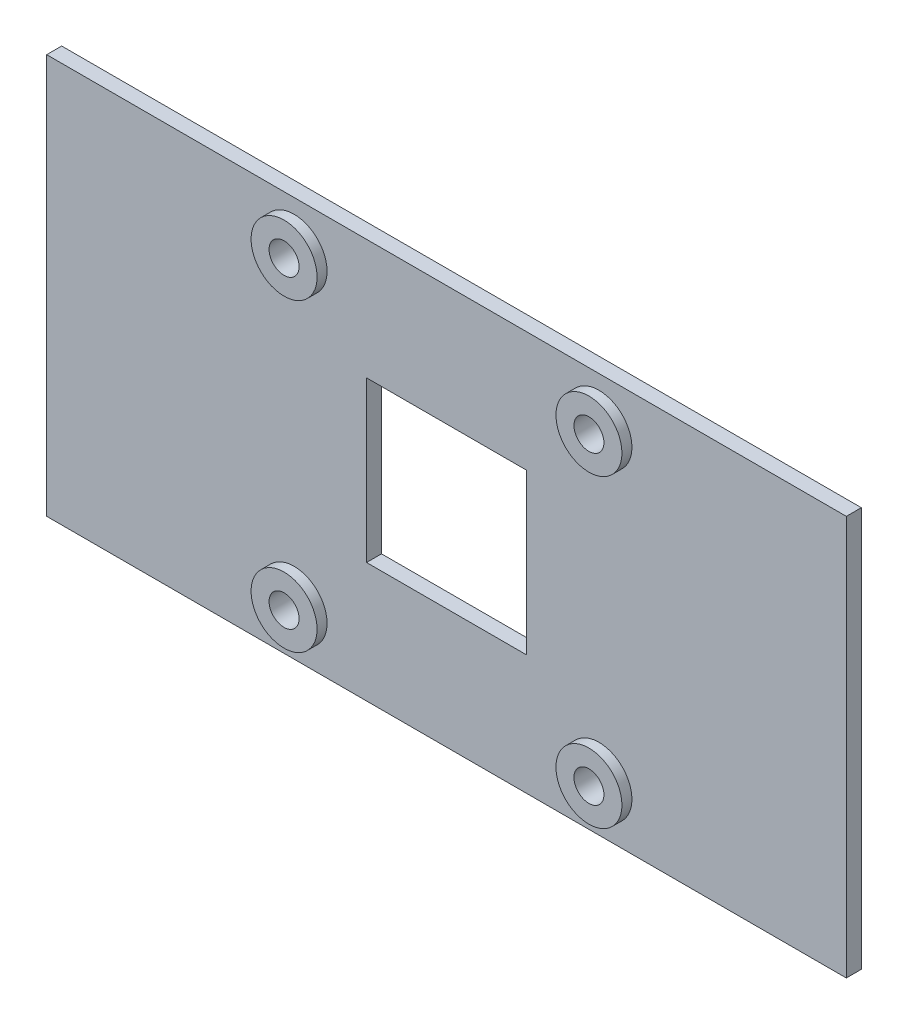
from build123d import *

# Parameters (mm, degrees)
SKETCH_2_W      = 80
SKETCH_2_H      = 40
SKETCH_2_R      = 1.5
EXTRUDE_1_DEPTH = 1.5
SKETCH_3_R      = 3.3
SKETCH_3_R_2    = 1.5
EXTRUDE_2_DEPTH = 1


with BuildPart() as part:
    # 草图2 → 凸台-拉伸1 (new body)
    with BuildSketch(Plane.XY):
        with Locations((-7.229146383, 0.256789608)):
            Rectangle(SKETCH_2_W, SKETCH_2_H)
        with Locations((-22.479146383, 15.506789608)):
            Circle(SKETCH_2_R, mode=Mode.SUBTRACT)
        with Locations(Location((8.020853617, 15.506789608, 0), (0, 0, 180))):
            Circle(SKETCH_2_R, mode=Mode.SUBTRACT)
        with Locations((8.020853617, -14.993210392)):
            Circle(SKETCH_2_R, mode=Mode.SUBTRACT)
        with Locations(Location((-22.479146383, -14.993210392, 0), (0, 0, 180))):
            Circle(SKETCH_2_R, mode=Mode.SUBTRACT)
        Polygon((-7.229146383, -7.743210392), (0.770853617, -7.743210392), (0.770853617, 8.256789608), (-15.229146383, 8.256789608), (-15.229146383, -7.743210392), align=None, mode=Mode.SUBTRACT)
    extrude(amount=EXTRUDE_1_DEPTH)

    # 草图3 → 凸台-拉伸2 (add)
    # profile 1 of 4: a face of its own
    with BuildSketch(Plane.XY.offset(1.5)):
        with Locations((-22.479146383, 15.506789608)):
            Circle(SKETCH_3_R)
        with Locations((-22.479146383, 15.506789608)):
            Circle(SKETCH_3_R_2, mode=Mode.SUBTRACT)
    # profile 2 of 4: a face of its own
    with BuildSketch(Plane.XY.offset(1.5)):
        with Locations((8.020853617, 15.506789608)):
            Circle(SKETCH_3_R)
        with Locations(Location((8.020853617, 15.506789608, 0), (0, 0, 180))):
            Circle(SKETCH_3_R_2, mode=Mode.SUBTRACT)
    # profile 3 of 4: a face of its own
    with BuildSketch(Plane.XY.offset(1.5)):
        with Locations((-22.479146383, -14.993210392)):
            Circle(SKETCH_3_R)
        with Locations(Location((-22.479146383, -14.993210392, 0), (0, 0, 180))):
            Circle(SKETCH_3_R_2, mode=Mode.SUBTRACT)
    # profile 4 of 4: a face of its own
    with BuildSketch(Plane.XY.offset(1.5)):
        with Locations((8.020853617, -14.993210392)):
            Circle(SKETCH_3_R)
        with Locations((8.020853617, -14.993210392)):
            Circle(SKETCH_3_R_2, mode=Mode.SUBTRACT)
    extrude(amount=EXTRUDE_2_DEPTH)


solid = part.part
